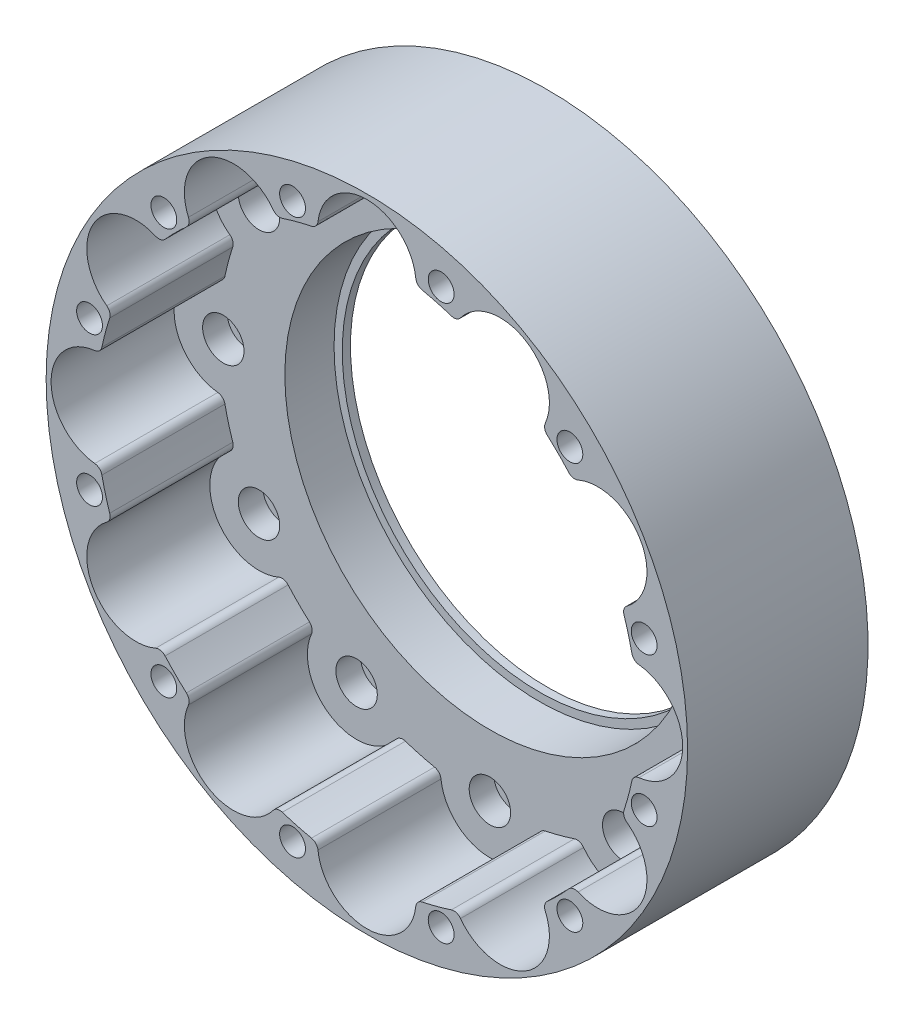
from build123d import *

# Parameters (mm, degrees)
SKETCH1_R           = 39.1
SKETCH1_R_2         = 2.525
SKETCH1_R_3         = 16
BOSS_EXTRUDE1_DEPTH = 3
BOSS_EXTRUDE2_START = 4
SKETCH2_R           = 39.1
SKETCH2_R_2         = 16
BOSS_EXTRUDE2_DEPTH = 4
SKETCH5_R           = 39.1
BOSS_EXTRUDE4_DEPTH = 15
FILLET2_R           = 1
SKETCH7_R           = 1.575
CUT_EXTRUDE1_DEPTH  = 60.51151166
CUT_EXTRUDE3_DEPTH  = 3
CUT_EXTRUDE7_START  = -7
SKETCH4_R           = 25
CUT_EXTRUDE7_DEPTH  = 6
CUT_EXTRUDE9_START  = -7
SKETCH4_5_R         = 24
SKETCH4_5_R_2       = 16
CUT_EXTRUDE9_DEPTH  = 67.51151166


with BuildPart() as part:
    # Sketch1 → Boss-Extrude1 (new body)
    with BuildSketch(Plane.XY):
        Circle(SKETCH1_R)
        with Locations((32.5, 0)):
            Circle(SKETCH1_R_2, mode=Mode.SUBTRACT)
        with Locations((28.145825623, -16.25)):
            Circle(SKETCH1_R_2, mode=Mode.SUBTRACT)
        with Locations((16.25, -28.145825623)):
            Circle(SKETCH1_R_2, mode=Mode.SUBTRACT)
        with Locations((0, -32.5)):
            Circle(SKETCH1_R_2, mode=Mode.SUBTRACT)
        with Locations((-16.25, -28.145825623)):
            Circle(SKETCH1_R_2, mode=Mode.SUBTRACT)
        with Locations((-28.145825623, -16.25)):
            Circle(SKETCH1_R_2, mode=Mode.SUBTRACT)
        with Locations((-32.5, 0)):
            Circle(SKETCH1_R_2, mode=Mode.SUBTRACT)
        with Locations((-28.145825623, 16.25)):
            Circle(SKETCH1_R_2, mode=Mode.SUBTRACT)
        with Locations((-16.25, 28.145825623)):
            Circle(SKETCH1_R_2, mode=Mode.SUBTRACT)
        with Locations((0, 32.5)):
            Circle(SKETCH1_R_2, mode=Mode.SUBTRACT)
        with Locations((16.25, 28.145825623)):
            Circle(SKETCH1_R_2, mode=Mode.SUBTRACT)
        Circle(SKETCH1_R_3, mode=Mode.SUBTRACT)
        with Locations((28.145825623, 16.25)):
            Circle(SKETCH1_R_2, mode=Mode.SUBTRACT)
    extrude(amount=BOSS_EXTRUDE1_DEPTH)

    # Sketch2 → Boss-Extrude2 (add)
    with BuildSketch(Plane(origin=(0, 0, 0), x_dir=(-1, 0, 0), z_dir=(0, 0, -1)).offset(BOSS_EXTRUDE2_START)):
        Circle(SKETCH2_R)
        Circle(SKETCH2_R_2, mode=Mode.SUBTRACT)
    extrude(amount=-BOSS_EXTRUDE2_DEPTH)

    # Sketch5 → Boss-Extrude4 (add)
    with BuildSketch(Plane.XY.offset(3)):
        with Locations(Location((0, 0, 0), (0, 0, 180))):
            Circle(SKETCH5_R)
        with BuildLine():
            ThreePointArc((-11.029028002, 31.102420184), (-19.25, 33.341978046), (-21.420971998, 25.102628521))
            ThreePointArc((-21.420971998, 25.102628521), (-23.334523779, 23.334523779), (-25.102628521, 21.420971998))
            ThreePointArc((-25.102628521, 21.420971998), (-33.341978046, 19.25), (-31.102420184, 11.029028002))
            ThreePointArc((-31.102420184, 11.029028002), (-31.875552268, 8.541028488), (-32.45, 5.999791663))
            ThreePointArc((-32.45, 5.999791663), (-38.5, 0), (-32.45, -5.999791663))
            ThreePointArc((-32.45, -5.999791663), (-31.875552268, -8.541028488), (-31.102420184, -11.029028002))
            ThreePointArc((-31.102420184, -11.029028002), (-33.341978046, -19.25), (-25.102628521, -21.420971998))
            ThreePointArc((-25.102628521, -21.420971998), (-23.334523779, -23.334523779), (-21.420971998, -25.102628521))
            ThreePointArc((-21.420971998, -25.102628521), (-19.25, -33.341978046), (-11.029028002, -31.102420184))
            ThreePointArc((-11.029028002, -31.102420184), (-8.541028488, -31.875552268), (-5.999791663, -32.45))
            ThreePointArc((-5.999791663, -32.45), (0, -38.5), (5.999791663, -32.45))
            ThreePointArc((5.999791663, -32.45), (8.541028488, -31.875552268), (11.029028002, -31.102420184))
            ThreePointArc((11.029028002, -31.102420184), (19.25, -33.341978046), (21.420971998, -25.102628521))
            ThreePointArc((21.420971998, -25.102628521), (23.334523779, -23.334523779), (25.102628521, -21.420971998))
            ThreePointArc((25.102628521, -21.420971998), (33.341978046, -19.25), (31.102420184, -11.029028002))
            ThreePointArc((31.102420184, -11.029028002), (31.875552268, -8.541028488), (32.45, -5.999791663))
            ThreePointArc((32.45, -5.999791663), (38.5, 0), (32.45, 5.999791663))
            ThreePointArc((32.45, 5.999791663), (31.875552268, 8.541028488), (31.102420184, 11.029028002))
            ThreePointArc((31.102420184, 11.029028002), (33.341978046, 19.25), (25.102628521, 21.420971998))
            ThreePointArc((25.102628521, 21.420971998), (23.334523779, 23.334523779), (21.420971998, 25.102628521))
            ThreePointArc((21.420971998, 25.102628521), (19.25, 33.341978046), (11.029028002, 31.102420184))
            ThreePointArc((11.029028002, 31.102420184), (8.541028488, 31.875552268), (5.999791663, 32.45))
            ThreePointArc((5.999791663, 32.45), (0, 38.5), (-5.999791663, 32.45))
            ThreePointArc((-5.999791663, 32.45), (-8.541028488, 31.875552268), (-11.029028002, 31.102420184))
        make_face(mode=Mode.SUBTRACT)
    extrude(amount=BOSS_EXTRUDE4_DEPTH)

    # Fillet2
    fillet2_edges = [part.edges().sort_by_distance(p)[0] for p in [
        (32.45, -5.999791663, 10.5),
        (31.102420184, -11.029028002, 10.5),
        (25.102628521, -21.420971998, 10.5),
        (21.420971998, -25.102628521, 10.5),
        (11.029028002, -31.102420184, 10.5),
        (5.999791663, -32.45, 10.5),
        (-5.999791663, -32.45, 10.5),
        (-11.029028002, -31.102420184, 10.5),
        (-21.420971998, -25.102628521, 10.5),
        (-25.102628521, -21.420971998, 10.5),
        (-31.102420184, -11.029028002, 10.5),
        (-32.45, -5.999791663, 10.5),
        (-32.45, 5.999791663, 10.5),
        (-31.102420184, 11.029028002, 10.5),
        (-25.102628521, 21.420971998, 10.5),
        (-21.420971998, 25.102628521, 10.5),
        (-11.029028002, 31.102420184, 10.5),
        (-5.999791663, 32.45, 10.5),
        (5.999791663, 32.45, 10.5),
        (11.029028002, 31.102420184, 10.5),
        (21.420971998, 25.102628521, 10.5),
        (25.102628521, 21.420971998, 10.5),
        (31.102420184, 11.029028002, 10.5),
        (32.45, 5.999791663, 10.5),
    ]]
    fillet(fillet2_edges, radius=FILLET2_R)

    # Sketch7 → Cut-Extrude1 (cut, through all)
    with BuildSketch(Plane(origin=(0, 0, -4), x_dir=(-1, 0, 0), z_dir=(0, 0, -1))):
        with Locations((33.80740392, -9.058666579)):
            Circle(SKETCH7_R)
        with Locations((24.748737342, -24.748737342)):
            Circle(SKETCH7_R)
        with Locations((9.058666579, -33.80740392)):
            Circle(SKETCH7_R)
        with Locations((-9.058666579, -33.80740392)):
            Circle(SKETCH7_R)
        with Locations((-24.748737342, -24.748737342)):
            Circle(SKETCH7_R)
        with Locations((-33.80740392, -9.058666579)):
            Circle(SKETCH7_R)
        with Locations((-33.80740392, 9.058666579)):
            Circle(SKETCH7_R)
        with Locations((-24.748737342, 24.748737342)):
            Circle(SKETCH7_R)
        with Locations((-9.058666579, 33.80740392)):
            Circle(SKETCH7_R)
        with Locations((9.058666579, 33.80740392)):
            Circle(SKETCH7_R)
        with Locations((24.748737342, 24.748737342)):
            Circle(SKETCH7_R)
        with Locations((33.80740392, 9.058666579)):
            Circle(SKETCH7_R)
    extrude(amount=-CUT_EXTRUDE1_DEPTH, mode=Mode.SUBTRACT)

    # Sketch8 → Cut-Extrude3 (cut)
    with BuildSketch(Plane(origin=(0, 0, -4), x_dir=(-1, 0, 0), z_dir=(0, 0, -1))):
        Polygon((27.598737342, -26.394185609), (27.598737342, -23.103289074), (24.748737342, -21.457840807), (21.898737342, -23.103289074), (21.898737342, -26.394185609), (24.748737342, -28.039633876), align=None)
        Polygon((37.098300454, -9.058666579), (35.452852187, -6.208666579), (32.161955653, -6.208666579), (30.516507386, -9.058666579), (32.161955653, -11.908666579), (35.452852187, -11.908666579), align=None)
        Polygon((10.704114846, -36.65740392), (12.349563113, -33.80740392), (10.704114846, -30.95740392), (7.413218311, -30.95740392), (5.767770044, -33.80740392), (7.413218311, -36.65740392), align=None)
        Polygon((-9.058666579, -37.098300454), (-6.208666579, -35.452852187), (-6.208666579, -32.161955653), (-9.058666579, -30.516507386), (-11.908666579, -32.161955653), (-11.908666579, -35.452852187), align=None)
        Polygon((-26.394185609, -27.598737342), (-23.103289074, -27.598737342), (-21.457840807, -24.748737342), (-23.103289074, -21.898737342), (-26.394185609, -21.898737342), (-28.039633876, -24.748737342), align=None)
        Polygon((-36.65740392, -10.704114846), (-33.80740392, -12.349563113), (-30.95740392, -10.704114846), (-30.95740392, -7.413218311), (-33.80740392, -5.767770044), (-36.65740392, -7.413218311), align=None)
        Polygon((-37.098300454, 9.058666579), (-35.452852187, 6.208666579), (-32.161955653, 6.208666579), (-30.516507386, 9.058666579), (-32.161955653, 11.908666579), (-35.452852187, 11.908666579), align=None)
        Polygon((-27.598737342, 26.394185609), (-27.598737342, 23.103289074), (-24.748737342, 21.457840807), (-21.898737342, 23.103289074), (-21.898737342, 26.394185609), (-24.748737342, 28.039633876), align=None)
        Polygon((-10.704114846, 36.65740392), (-12.349563113, 33.80740392), (-10.704114846, 30.95740392), (-7.413218311, 30.95740392), (-5.767770044, 33.80740392), (-7.413218311, 36.65740392), align=None)
        Polygon((9.058666579, 37.098300454), (6.208666579, 35.452852187), (6.208666579, 32.161955653), (9.058666579, 30.516507386), (11.908666579, 32.161955653), (11.908666579, 35.452852187), align=None)
        Polygon((26.394185609, 27.598737342), (23.103289074, 27.598737342), (21.457840807, 24.748737342), (23.103289074, 21.898737342), (26.394185609, 21.898737342), (28.039633876, 24.748737342), align=None)
        Polygon((36.65740392, 10.704114846), (33.80740392, 12.349563113), (30.95740392, 10.704114846), (30.95740392, 7.413218311), (33.80740392, 5.767770044), (36.65740392, 7.413218311), align=None)
    extrude(amount=-CUT_EXTRUDE3_DEPTH, mode=Mode.SUBTRACT)

    # Sketch4 → Cut-Extrude7 (cut)
    with BuildSketch(Plane(origin=(0, 0, -4), x_dir=(-1, 0, 0), z_dir=(0, 0, -1)).offset(CUT_EXTRUDE7_START)):
        with Locations(Location((0, 0, 0), (0, 0, 180))):
            Circle(SKETCH4_R)
    extrude(amount=CUT_EXTRUDE7_DEPTH, mode=Mode.SUBTRACT)

    # Sketch4<5> → Cut-Extrude9 (cut, through all)
    with BuildSketch(Plane(origin=(0, 0, -4), x_dir=(-1, 0, 0), z_dir=(0, 0, -1)).offset(CUT_EXTRUDE9_START)):
        with Locations(Location((0, 0, 0), (0, 0, 180))):
            Circle(SKETCH4_5_R)
        Circle(SKETCH4_5_R_2, mode=Mode.SUBTRACT)
    extrude(amount=CUT_EXTRUDE9_DEPTH, mode=Mode.SUBTRACT)


solid = part.part
